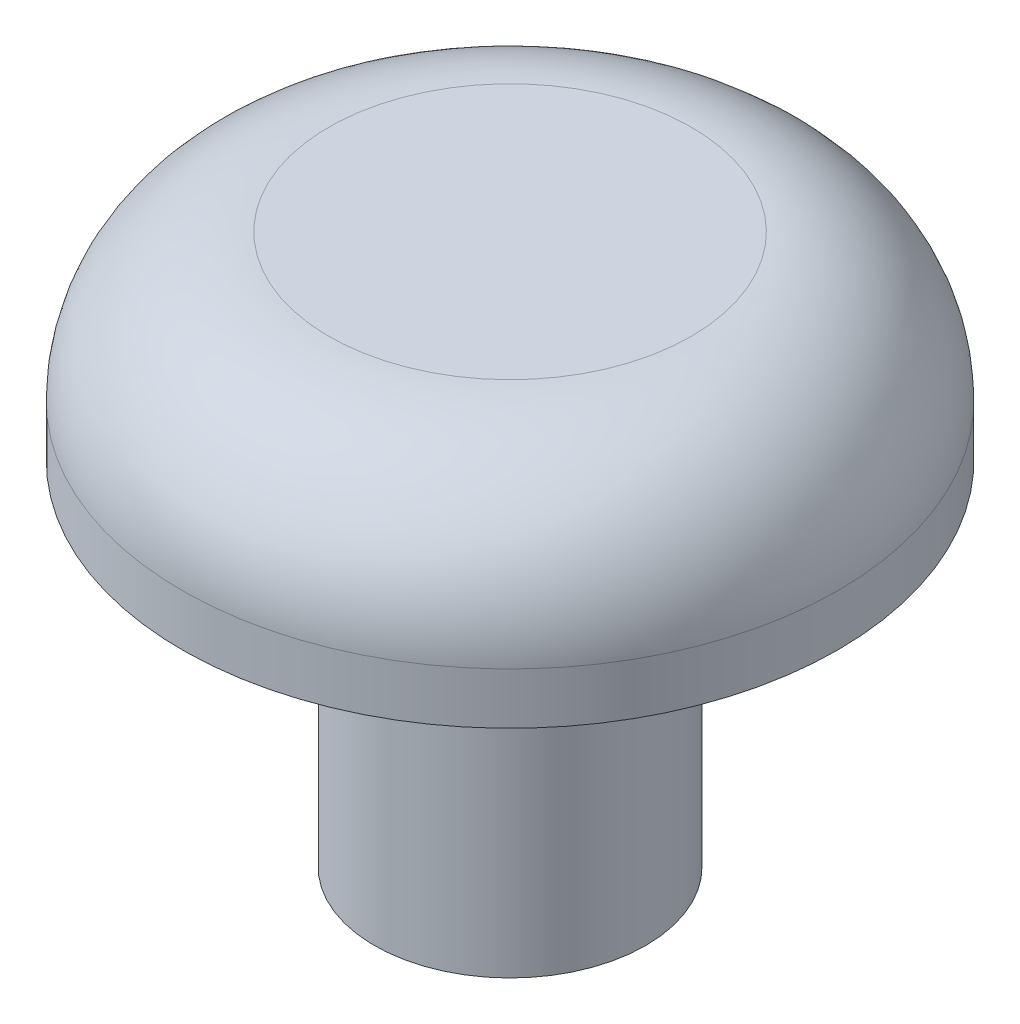
from build123d import *

# Parameters (mm, degrees)
FILLET1_R                 = 2.54
F_6_32_TAPPED_HOLE1_D     = 2.7051
F_6_32_TAPPED_HOLE1_DEPTH = 5.8928
F_6_32_TAPPED_HOLE1_TIP   = 0.81269403


with BuildPart() as part:
    # Sketch1 → Revolve1 (revolve)
    with BuildSketch(Plane.XY, mode=Mode.PRIVATE) as revolve1_sk:
        Polygon((0, 0), (-5.6769, 0), (-5.6769, -3.429), (-2.3495, -3.429), (-2.3495, -9.525), (0, -9.525), align=None)
    revolve(revolve1_sk.sketch.rotate(Axis((0, -9.525, 0), (0, 1, 0)), 180), axis=Axis((0, -9.525, 0), (0, 1, 0)))

    # Fillet1
    fillet1_edges = [part.edges().sort_by_distance(p)[0] for p in [
        (-5.6769, 0, 0),
    ]]
    fillet(fillet1_edges, radius=FILLET1_R)

    # #6-32 Tapped Hole1
    with Locations(Plane.XZ.offset(9.525)):
        with Locations((0, 0)):
            Hole(F_6_32_TAPPED_HOLE1_D / 2, depth=F_6_32_TAPPED_HOLE1_DEPTH)
            with Locations((0, 0, -(F_6_32_TAPPED_HOLE1_DEPTH + F_6_32_TAPPED_HOLE1_TIP / 2))):  # 118° drill point
                Cone(0, F_6_32_TAPPED_HOLE1_D / 2, F_6_32_TAPPED_HOLE1_TIP, mode=Mode.SUBTRACT)


solid = part.part
